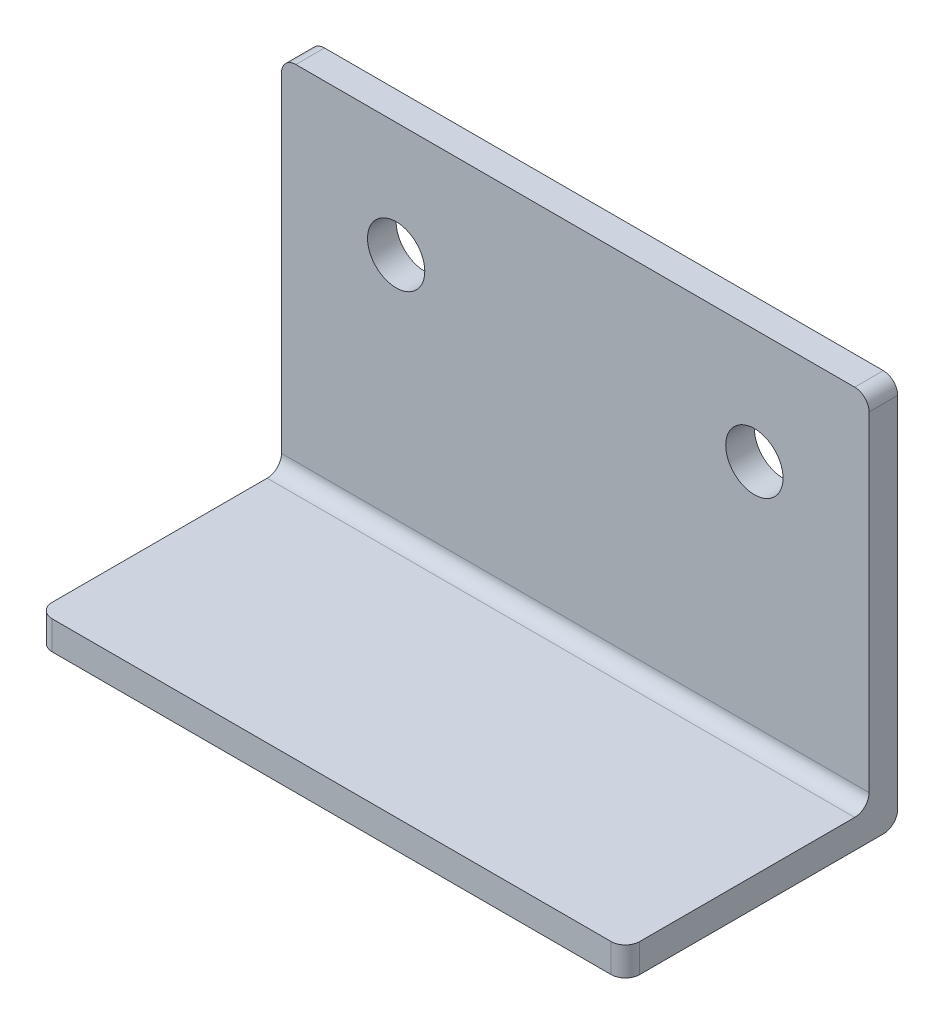
from build123d import *

# Parameters (mm, degrees)
SKETCH_1_W          = 41
SKETCH_1_H          = 19
EXTRUDE_2_DEPTH     = 2
SKETCH_2_W          = 41
SKETCH_2_H          = 2
EXTRUDE_3_DEPTH     = 25
SKETCH_3_R          = 2
CUT_EXTRUDE_1_DEPTH = 25
FILLET_1_R          = 1
FILLET_2_R          = 1
FILLET_3_R          = 1
FILLET_4_R          = 1
FILLET_5_R          = 1
FILLET_6_R          = 1


with BuildPart() as part:
    # 草图1 → 凸台-拉伸2 (new body)
    with BuildSketch(Plane(origin=(0, 0, 0), x_dir=(1, 0, 0), z_dir=(0, 1, 0))):
        Rectangle(SKETCH_1_W, SKETCH_1_H)
    extrude(amount=EXTRUDE_2_DEPTH)

    # 草图2 → 凸台-拉伸3 (add)
    with BuildSketch(Plane(origin=(0, 2, 0), x_dir=(1, 0, 0), z_dir=(0, 1, 0))):
        with Locations((0, 8.5)):
            Rectangle(SKETCH_2_W, SKETCH_2_H)
    extrude(amount=EXTRUDE_3_DEPTH)

    # 草图3 → 切除-拉伸1 (cut)
    with BuildSketch(Plane.XY.offset(-7.5)):
        with Locations((-12.5, 19)):
            Circle(SKETCH_3_R)
        with Locations((12.5, 19)):
            Circle(SKETCH_3_R)
    extrude(amount=-CUT_EXTRUDE_1_DEPTH, mode=Mode.SUBTRACT)

    # 圆角1
    fillet_1_edges = [part.edges().sort_by_distance(p)[0] for p in [
        (0, 2, -7.5),
    ]]
    fillet(fillet_1_edges, radius=FILLET_1_R)

    # 圆角2
    fillet_2_edges = [part.edges().sort_by_distance(p)[0] for p in [
        (0, 0, -9.5),
    ]]
    fillet(fillet_2_edges, radius=FILLET_2_R)

    # 圆角3
    fillet_3_edges = [part.edges().sort_by_distance(p)[0] for p in [
        (-20.5, 1, 9.5),
    ]]
    fillet(fillet_3_edges, radius=FILLET_3_R)

    # 圆角4
    fillet_4_edges = [part.edges().sort_by_distance(p)[0] for p in [
        (20.5, 1, 9.5),
    ]]
    fillet(fillet_4_edges, radius=FILLET_4_R)

    # 圆角5
    fillet_5_edges = [part.edges().sort_by_distance(p)[0] for p in [
        (-20.5, 27, -8.5),
    ]]
    fillet(fillet_5_edges, radius=FILLET_5_R)

    # 圆角6
    fillet_6_edges = [part.edges().sort_by_distance(p)[0] for p in [
        (20.5, 27, -8.5),
    ]]
    fillet(fillet_6_edges, radius=FILLET_6_R)


solid = part.part
